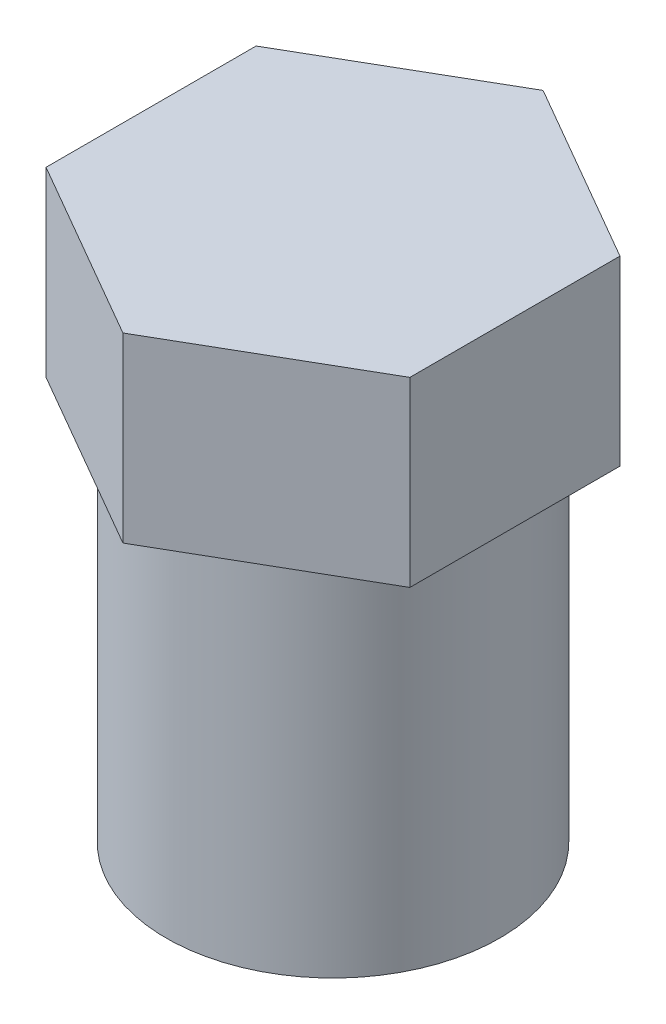
from build123d import *

# Parameters (mm, degrees)
EXTRUDE_1_DEPTH     = 6
SKETCH_2_R          = 5.5
EXTRUDE_2_DEPTH     = 12
SKETCH_3_R          = 2
CUT_EXTRUDE_1_DEPTH = 12
SKETCH_4_R          = 3
CUT_EXTRUDE_2_DEPTH = 12


with BuildPart() as part:
    # 草图1 → 凸台-拉伸1 (new body)
    with BuildSketch(Plane(origin=(0, 0, 0), x_dir=(1, 0, 0), z_dir=(0, 1, 0))):
        Polygon((0, 6.92820323), (-6, 3.464101615), (-6, -3.464101615), (0, -6.92820323), (6, -3.464101615), (6, 3.464101615), align=None)
    extrude(amount=EXTRUDE_1_DEPTH)

    # 草图2 → 凸台-拉伸2 (add)
    with BuildSketch(Plane.XZ):
        with Locations(Location((0, 0, 0), (0, 0, 270))):
            Circle(SKETCH_2_R)
    extrude(amount=EXTRUDE_2_DEPTH)

    # 草图3 → 切除-拉伸1 (cut)
    with BuildSketch(Plane(origin=(0, 0, 0), x_dir=(0, 0, -1), z_dir=(1, 0, 0))):
        with Locations((0, -7)):
            Circle(SKETCH_3_R)
    extrude(amount=-CUT_EXTRUDE_1_DEPTH, mode=Mode.SUBTRACT)

    # 草图4 → 切除-拉伸2 (cut)
    with BuildSketch(Plane.XZ.offset(12)):
        with Locations(Location((0, 0, 0), (0, 0, 270))):
            Circle(SKETCH_4_R)
    extrude(amount=-CUT_EXTRUDE_2_DEPTH, mode=Mode.SUBTRACT)


solid = part.part
